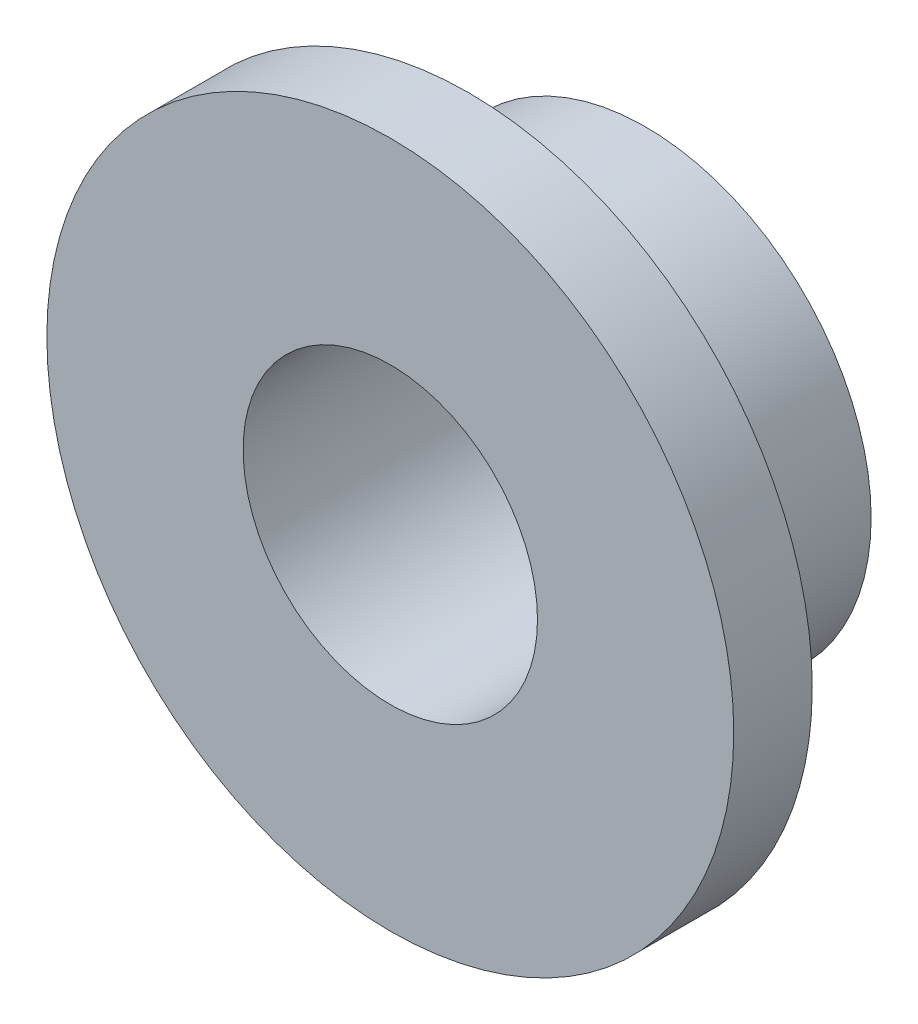
from build123d import *

# Parameters (mm, degrees)
CROQUIS1_R              = 11.5
CROQUIS1_R_2            = 7.5
SALIENTE_EXTRUIR1_DEPTH = 9
CROQUIS2_R              = 17.5
CROQUIS2_R_2            = 7.5
SALIENTE_EXTRUIR2_DEPTH = 4


with BuildPart() as part:
    # Croquis1 → Saliente-Extruir1 (new body)
    with BuildSketch(Plane.XY):
        Circle(CROQUIS1_R)
        Circle(CROQUIS1_R_2, mode=Mode.SUBTRACT)
    extrude(amount=SALIENTE_EXTRUIR1_DEPTH)

    # Croquis2 → Saliente-Extruir2 (add)
    with BuildSketch(Plane.XY.offset(9)):
        Circle(CROQUIS2_R)
        Circle(CROQUIS2_R_2, mode=Mode.SUBTRACT)
    extrude(amount=SALIENTE_EXTRUIR2_DEPTH)


solid = part.part
